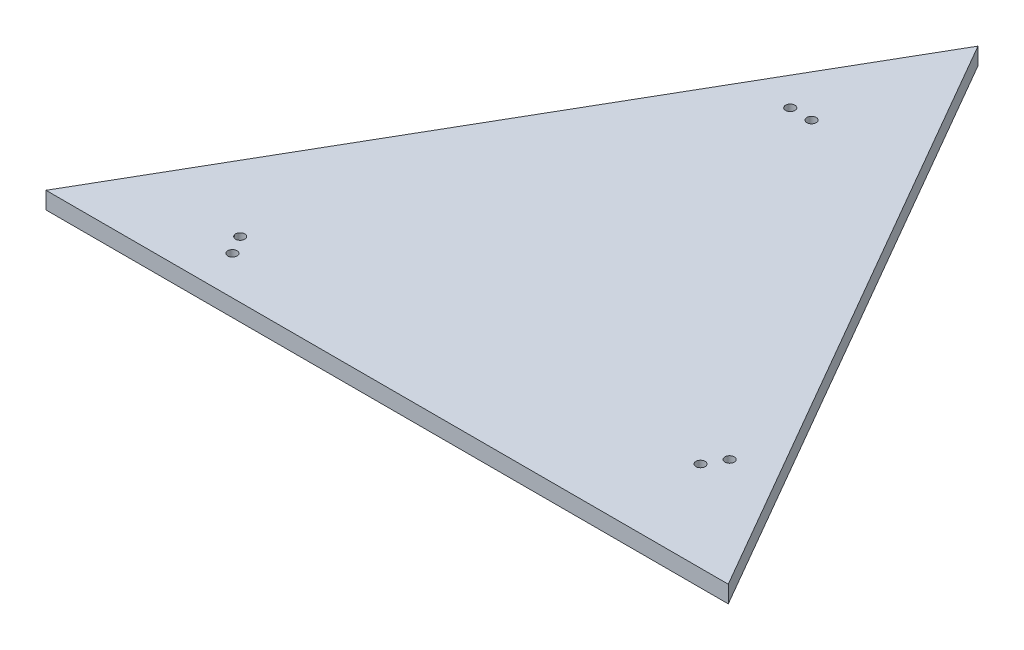
from build123d import *

# Parameters (mm, degrees)
BOSS_EXTRUDE1_DEPTH = 6.35
SKETCH2_R           = 1.7272
CUT_EXTRUDE1_DEPTH  = 195.099602868


with BuildPart() as part:
    # Sketch1 → Boss-Extrude1 (new body)
    with BuildSketch(Plane(origin=(0, 0, 0), x_dir=(1, 0, 0), z_dir=(0, 1, 0))):
        Polygon((0, 146.646968374), (-127, -73.323484187), (127, -73.323484187), align=None)
    extrude(amount=BOSS_EXTRUDE1_DEPTH)

    # Sketch2 → Cut-Extrude1 (cut, through all)
    with BuildSketch(Plane(origin=(0, 6.35, 0), x_dir=(1, 0, 0), z_dir=(0, 1, 0))):
        with Locations((83.080121807, -39.724771067)):
            Circle(SKETCH2_R)
        with Locations((87.042521807, -32.861692947)):
            Circle(SKETCH2_R)
        with Locations((-75.942721807, -52.087110501)):
            Circle(SKETCH2_R)
        with Locations((-71.980321807, -58.950188621)):
            Circle(SKETCH2_R)
        with Locations((-7.1374, 91.811881567)):
            Circle(SKETCH2_R)
        with Locations((-15.0622, 91.811881567)):
            Circle(SKETCH2_R)
    extrude(amount=-CUT_EXTRUDE1_DEPTH, mode=Mode.SUBTRACT)


solid = part.part
